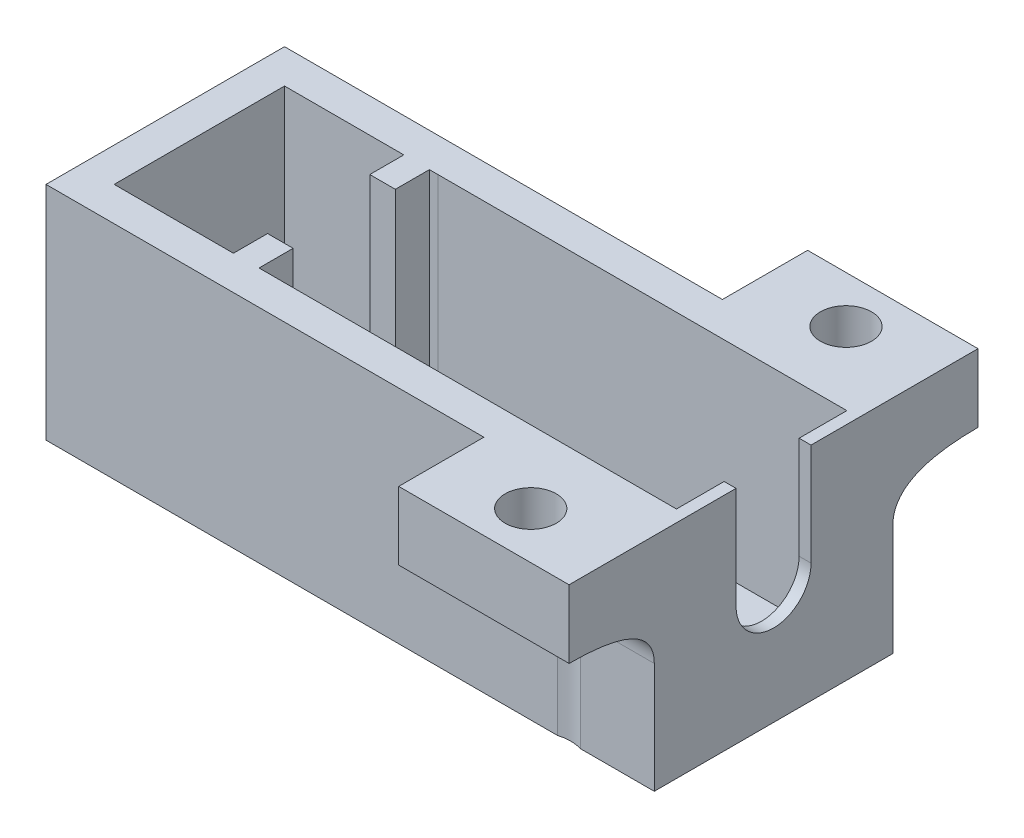
from build123d import *

# Parameters (mm, degrees)
SKETCH1_W            = 25.7
SKETCH1_H            = 16
BOSS_EXTRUDE5_DEPTH  = 13
SKETCH3_W            = 24
SKETCH3_H            = 10
CUT_EXTRUDE1_DEPTH   = 12
SKETCH6_W            = 6
SKETCH6_H            = 12
CUT_EXTRUDE6_DEPTH   = 12
SKETCH12_W           = 25.7
SKETCH12_H           = 13
CUT_EXTRUDE9_DEPTH   = 1
SKETCH13_W           = 25.7
SKETCH13_H           = 13
CUT_EXTRUDE10_DEPTH  = 1
SKETCH14_W           = 25.7
SKETCH14_H           = 0.24
CUT_EXTRUDE11_DEPTH  = 26.979383268
SKETCH15_W           = 25.7
SKETCH15_H           = 0.24
BOSS_EXTRUDE6_DEPTH  = 13
BOSS_EXTRUDE8_DEPTH  = 10
SKETCH19_R           = 2.35
CUT_EXTRUDE12_DEPTH  = 29.801827185
SKETCH20_R           = 2.4
SKETCH20_R_2         = 2.45
BOSS_EXTRUDE9_DEPTH  = 2.5
SKETCH21_R           = 1.5
CUT_EXTRUDE13_DEPTH  = 29.801827185
SKETCH22_W           = 10
SKETCH22_H           = 14
BOSS_EXTRUDE11_DEPTH = 13
SKETCH25_W           = 8
SKETCH25_H           = 10
CUT_EXTRUDE17_DEPTH  = 12
SKETCH26_W           = 1.5
SKETCH26_H           = 2
BOSS_EXTRUDE12_DEPTH = 13
SKETCH27_W           = 0.5
SKETCH27_H           = 1.76
SKETCH27_W_2         = 0.500587584
SKETCH27_H_2         = 2
CUT_EXTRUDE18_DEPTH  = 12
SKETCH28_W           = 1.277363426
SKETCH28_H           = 0.860849325
BOSS_EXTRUDE13_DEPTH = 12
CUT_EXTRUDE20_DEPTH  = 12


with BuildPart() as part:
    # Sketch1 → Boss-Extrude5 (new body)
    with BuildSketch(Plane(origin=(0, 0, 0), x_dir=(1, 0, 0), z_dir=(0, 1, 0))):
        with Locations((4.864219333, 6.861269364)):
            Rectangle(SKETCH1_W, SKETCH1_H)
    extrude(amount=BOSS_EXTRUDE5_DEPTH)

    # Sketch3 → Cut-Extrude1 (cut)
    with BuildSketch(Plane(origin=(0, 13, 0), x_dir=(1, 0, 0), z_dir=(0, 1, 0))):
        with Locations((5.015394501, 6.623768503)):
            Rectangle(SKETCH3_W, SKETCH3_H)
    extrude(amount=-CUT_EXTRUDE1_DEPTH, mode=Mode.SUBTRACT)

    # Sketch6 → Cut-Extrude6 (cut)
    with BuildSketch(Plane.ZY.offset(7.985780667)):
        with Locations((-6.861269364, 7)):
            Rectangle(SKETCH6_W, SKETCH6_H)
    extrude(amount=-CUT_EXTRUDE6_DEPTH, mode=Mode.SUBTRACT)

    # Sketch12 → Cut-Extrude9 (cut)
    with BuildSketch(Plane(origin=(0, 0, -14.861269364), x_dir=(-1, 0, 0), z_dir=(0, 0, -1))):
        with Locations((-4.864219333, 6.5)):
            Rectangle(SKETCH12_W, SKETCH12_H)
    extrude(amount=-CUT_EXTRUDE9_DEPTH, mode=Mode.SUBTRACT)

    # Sketch13 → Cut-Extrude10 (cut)
    with BuildSketch(Plane.XY.offset(1.138730636)):
        with Locations((4.864219333, 6.5)):
            Rectangle(SKETCH13_W, SKETCH13_H)
    extrude(amount=-CUT_EXTRUDE10_DEPTH, mode=Mode.SUBTRACT)

    # Sketch14 → Cut-Extrude11 (cut, through all)
    with BuildSketch(Plane(origin=(0, 13, 0), x_dir=(1, 0, 0), z_dir=(0, 1, 0))):
        with Locations((4.864219333, 13.741269364)):
            Rectangle(SKETCH14_W, SKETCH14_H)
    extrude(amount=-CUT_EXTRUDE11_DEPTH, mode=Mode.SUBTRACT)

    # Sketch15 → Boss-Extrude6 (add)
    with BuildSketch(Plane(origin=(0, 13, 0), x_dir=(1, 0, 0), z_dir=(0, 1, 0))):
        with Locations((4.864219333, -0.258730636)):
            Rectangle(SKETCH15_W, SKETCH15_H)
    extrude(amount=-BOSS_EXTRUDE6_DEPTH)

    # Sketch17 → Boss-Extrude8 (add)
    with BuildSketch(Plane(origin=(17.714219333, 0, 0), x_dir=(0, 0, -1), z_dir=(1, 0, 0))):
        with BuildLine():
            Line((13.621269364, 13), (18.621269364, 13))
            Line((18.621269364, 13), (18.621269364, 9))
            add(Edge.make_bspline(
                [(18.621269364, 9), (13.621269364, 9), (13.621269364, 6.5)],
                knots=[0, 0, 0, 1, 1, 1], degree=2))
            Line((13.621269364, 6.5), (13.621269364, 13))
        make_face()
        with BuildLine():
            Line((-0.378730636, 13), (-5.378730636, 13))
            Line((-5.378730636, 13), (-5.378730636, 9))
            add(Edge.make_bspline(
                [(-5.378730636, 9), (-0.378730636, 9), (-0.378730636, 6.5)],
                knots=[0, 0, 0, 1, 1, 1], degree=2))
            Line((-0.378730636, 6.5), (-0.378730636, 13))
        make_face()
    extrude(amount=-BOSS_EXTRUDE8_DEPTH)

    # Sketch19 → Cut-Extrude12 (cut, through all)
    with BuildSketch(Plane(origin=(0, 13, 0), x_dir=(1, 0, 0), z_dir=(0, 1, 0))):
        with Locations(Location((12.714219333, 15.871269364, 0), (0, 0, 270))):
            Circle(SKETCH19_R)
        with Locations(Location((12.714219333, -2.628730636, 0), (0, 0, 270))):
            Circle(SKETCH19_R)
    extrude(amount=-CUT_EXTRUDE12_DEPTH, mode=Mode.SUBTRACT)

    # Sketch20 → Boss-Extrude9 (add)
    with BuildSketch(Plane(origin=(0, 13, 0), x_dir=(1, 0, 0), z_dir=(0, 1, 0))):
        with Locations((12.714219333, 15.871269364)):
            Circle(SKETCH20_R)
        with Locations((12.714219333, -2.628730636)):
            Circle(SKETCH20_R_2)
    extrude(amount=-BOSS_EXTRUDE9_DEPTH)

    # Sketch21 → Cut-Extrude13 (cut, through all)
    with BuildSketch(Plane(origin=(0, 13, 0), x_dir=(1, 0, 0), z_dir=(0, 1, 0))):
        with Locations(Location((12.714219333, 15.871269364, 0), (0, 0, 270))):
            Circle(SKETCH21_R)
        with Locations(Location((12.714219333, -2.628730636, 0), (0, 0, 270))):
            Circle(SKETCH21_R)
    extrude(amount=-CUT_EXTRUDE13_DEPTH, mode=Mode.SUBTRACT)

    # Sketch22 → Boss-Extrude11 (add)
    with BuildSketch(Plane(origin=(0, 13, 0), x_dir=(1, 0, 0), z_dir=(0, 1, 0))):
        with Locations((-12.985780667, 6.621269364)):
            Rectangle(SKETCH22_W, SKETCH22_H)
    extrude(amount=-BOSS_EXTRUDE11_DEPTH)

    # Sketch25 → Cut-Extrude17 (cut)
    with BuildSketch(Plane(origin=(0, 13, 0), x_dir=(1, 0, 0), z_dir=(0, 1, 0))):
        with Locations((-11.985780667, 6.621269364)):
            Rectangle(SKETCH25_W, SKETCH25_H)
    extrude(amount=-CUT_EXTRUDE17_DEPTH, mode=Mode.SUBTRACT)

    # Sketch26 → Boss-Extrude12 (add)
    with BuildSketch(Plane(origin=(0, 13, 0), x_dir=(1, 0, 0), z_dir=(0, 1, 0))):
        with Locations((-8.234605499, 2.623768503)):
            Rectangle(SKETCH26_W, SKETCH26_H)
        with Locations((-8.234605499, 10.623768503)):
            Rectangle(SKETCH26_W, SKETCH26_H)
    extrude(amount=-BOSS_EXTRUDE12_DEPTH)

    # Sketch27 → Cut-Extrude18 (cut)
    with BuildSketch(Plane(origin=(0, 13, 0), x_dir=(1, 0, 0), z_dir=(0, 1, 0))):
        with Locations((-7.234605499, 10.741269364)):
            Rectangle(SKETCH27_W, SKETCH27_H)
        Polygon((-7.985780667, 3.861269364), (-7.985780667, 3.623768503), (-7.485193083, 3.623768503), (-6.984605499, 3.623768503), (-6.984605499, 3.861269364), align=None)
        with Locations((-7.234899291, 2.623768503)):
            Rectangle(SKETCH27_W_2, SKETCH27_H_2)
    extrude(amount=-CUT_EXTRUDE18_DEPTH, mode=Mode.SUBTRACT)

    # Sketch28 → Boss-Extrude13 (add)
    with BuildSketch(Plane(origin=(0, 13, 0), x_dir=(1, 0, 0), z_dir=(0, 1, 0))):
        with Locations((-8.345923786, 1.388186548)):
            Rectangle(SKETCH28_W, SKETCH28_H)
    extrude(amount=-BOSS_EXTRUDE13_DEPTH)

    # Sketch35 → Cut-Extrude20 (cut)
    with BuildSketch(Plane(origin=(17.714219333, 0, 0), x_dir=(0, 0, -1), z_dir=(1, 0, 0))):
        with BuildLine():
            Line((4.421384975, 7), (4.421384975, 13))
            Line((4.421384975, 13), (8.821153753, 13))
            Line((8.821153753, 13), (8.821153753, 7))
            ThreePointArc((8.821153753, 7), (6.621269364, 4.800115611), (4.421384975, 7))
        make_face()
    extrude(amount=-CUT_EXTRUDE20_DEPTH, mode=Mode.SUBTRACT)


solid = part.part
